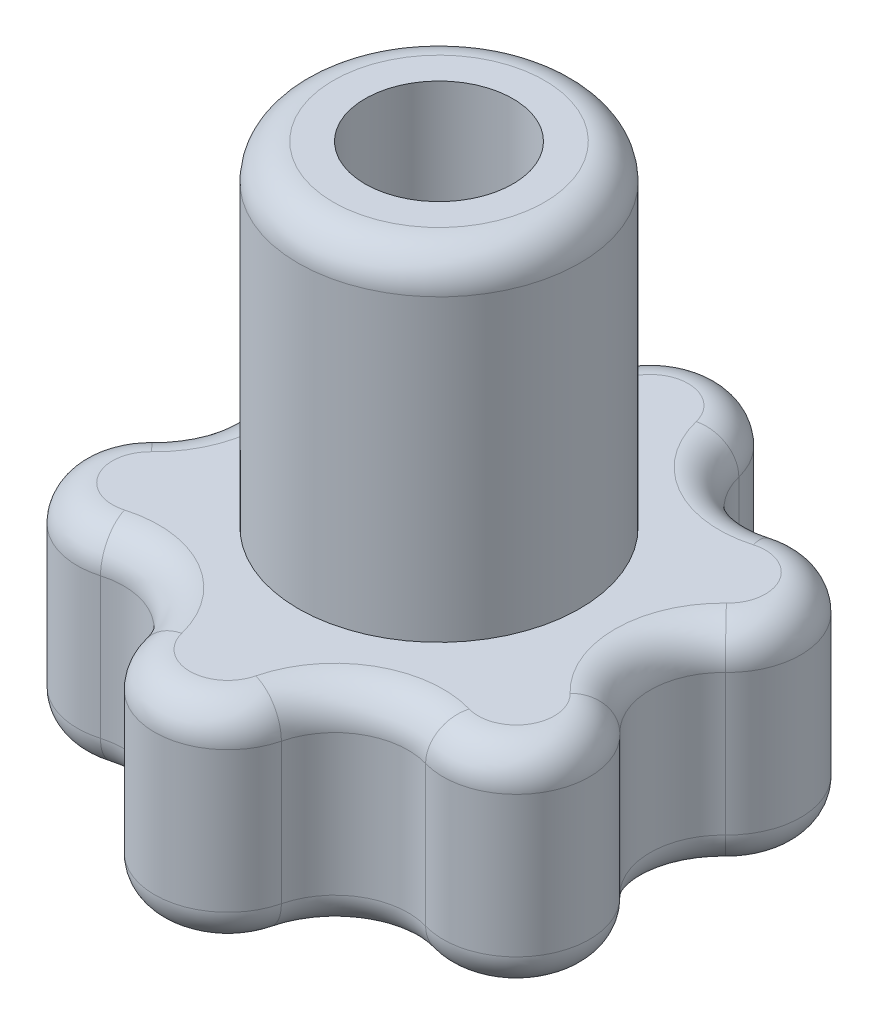
from build123d import *

# Parameters (mm, degrees)
EXTRUDE_1_DEPTH     = 6
SKETCH_2_R          = 4
EXTRUDE_2_DEPTH     = 9.5
SKETCH_3_R          = 2.1
CUT_EXTRUDE_1_DEPTH = 19.93435489
CUT_EXTRUDE_2_DEPTH = 3
FILLET_1_R          = 1


with BuildPart() as part:
    # Эскиз1 → Бобышка-Вытянуть1 (new body)
    with BuildSketch(Plane(origin=(0, 0, 0), x_dir=(1, 0, 0), z_dir=(0, 1, 0))):
        with BuildLine():
            ThreePointArc((2.020252334, 6.499179686), (0, 8.081009335), (-2.020252334, 6.499179686))
            ThreePointArc((-2.020252334, 6.499179686), (-3, 5.196152423), (-4.618328545, 4.999179686))
            ThreePointArc((-4.618328545, 4.999179686), (-6.998359372, 4.040504667), (-6.638580879, 1.5))
            ThreePointArc((-6.638580879, 1.5), (-6, 0), (-6.638580879, -1.5))
            ThreePointArc((-6.638580879, -1.5), (-6.998359372, -4.040504667), (-4.618328545, -4.999179686))
            ThreePointArc((-4.618328545, -4.999179686), (-3, -5.196152423), (-2.020252334, -6.499179686))
            ThreePointArc((-2.020252334, -6.499179686), (0, -8.081009335), (2.020252334, -6.499179686))
            ThreePointArc((2.020252334, -6.499179686), (3, -5.196152423), (4.618328545, -4.999179686))
            ThreePointArc((4.618328545, -4.999179686), (6.998359372, -4.040504667), (6.638580879, -1.5))
            ThreePointArc((6.638580879, -1.5), (6, 0), (6.638580879, 1.5))
            ThreePointArc((6.638580879, 1.5), (6.998359372, 4.040504667), (4.618328545, 4.999179686))
            ThreePointArc((4.618328545, 4.999179686), (3, 5.196152423), (2.020252334, 6.499179686))
        make_face()
    extrude(amount=EXTRUDE_1_DEPTH)

    # Эскиз2 → Бобышка-Вытянуть2 (add)
    with BuildSketch(Plane(origin=(0, 6, 0), x_dir=(1, 0, 0), z_dir=(0, 1, 0))):
        Circle(SKETCH_2_R)
    extrude(amount=EXTRUDE_2_DEPTH)

    # Эскиз3 → Вырез-Вытянуть1 (cut, through all)
    with BuildSketch(Plane(origin=(0, 15.5, 0), x_dir=(1, 0, 0), z_dir=(0, 1, 0))):
        Circle(SKETCH_3_R)
    extrude(amount=-CUT_EXTRUDE_1_DEPTH, mode=Mode.SUBTRACT)

    # Эскиз1<3> → Вырез-Вытянуть2 (cut)
    with BuildSketch(Plane(origin=(0, 0, 0), x_dir=(1, 0, 0), z_dir=(0, 1, 0))):
        Polygon((0, 4.214656965), (-3.65, 2.107328483), (-3.65, -2.107328483), (0, -4.214656965), (3.65, -2.107328483), (3.65, 2.107328483), align=None)
    extrude(amount=CUT_EXTRUDE_2_DEPTH, mode=Mode.SUBTRACT)

    # Скругление1
    fillet_1_edges = [part.edges().sort_by_distance(p)[0] for p in [
        (-3, 6, 5.196152423),
        (-6.998359372, 6, 4.040504667),
        (-6, 6, 0),
        (-6.998359372, 6, -4.040504667),
        (-3, 6, -5.196152423),
        (0, 6, -8.081009335),
        (3, 6, -5.196152423),
        (6.998359372, 6, -4.040504667),
        (6, 6, 0),
        (6.998359372, 6, 4.040504667),
        (3, 6, 5.196152423),
        (-3, 0, 5.196152423),
        (-6.998359372, 0, 4.040504667),
        (-6, 0, 0),
        (-6.998359372, 0, -4.040504667),
        (-3, 0, -5.196152423),
        (0, 0, -8.081009335),
        (3, 0, -5.196152423),
        (6.998359372, 0, -4.040504667),
        (6, 0, 0),
        (6.998359372, 0, 4.040504667),
        (3, 0, 5.196152423),
        (-4, 15.5, 0),
        (0, 6, 8.081009335),
        (0, 0, 8.081009335),
    ]]
    fillet(fillet_1_edges, radius=FILLET_1_R)


solid = part.part
